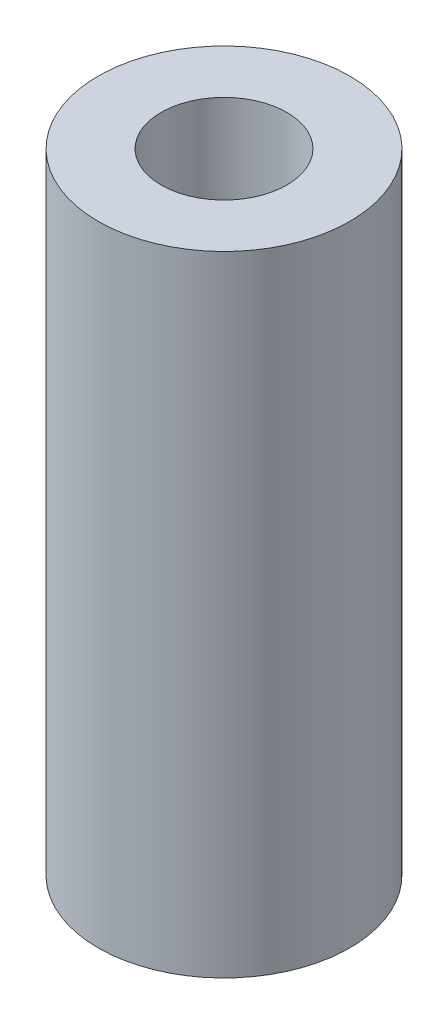
from build123d import *

# Parameters (mm, degrees)
CROQUIS1_R              = 4
CROQUIS1_R_2            = 2
SALIENTE_EXTRUIR1_DEPTH = 20


with BuildPart() as part:
    # Croquis1 → Saliente-Extruir1 (new body)
    with BuildSketch(Plane(origin=(0, 0, 0), x_dir=(1, 0, 0), z_dir=(0, 1, 0))):
        with Locations(Location((-11.648704121, -0.392912639, 0), (0, 0, 270))):
            Circle(CROQUIS1_R)
        with Locations(Location((-11.648704121, -0.392912639, 0), (0, 0, 270))):
            Circle(CROQUIS1_R_2, mode=Mode.SUBTRACT)
    extrude(amount=SALIENTE_EXTRUIR1_DEPTH)


solid = part.part
